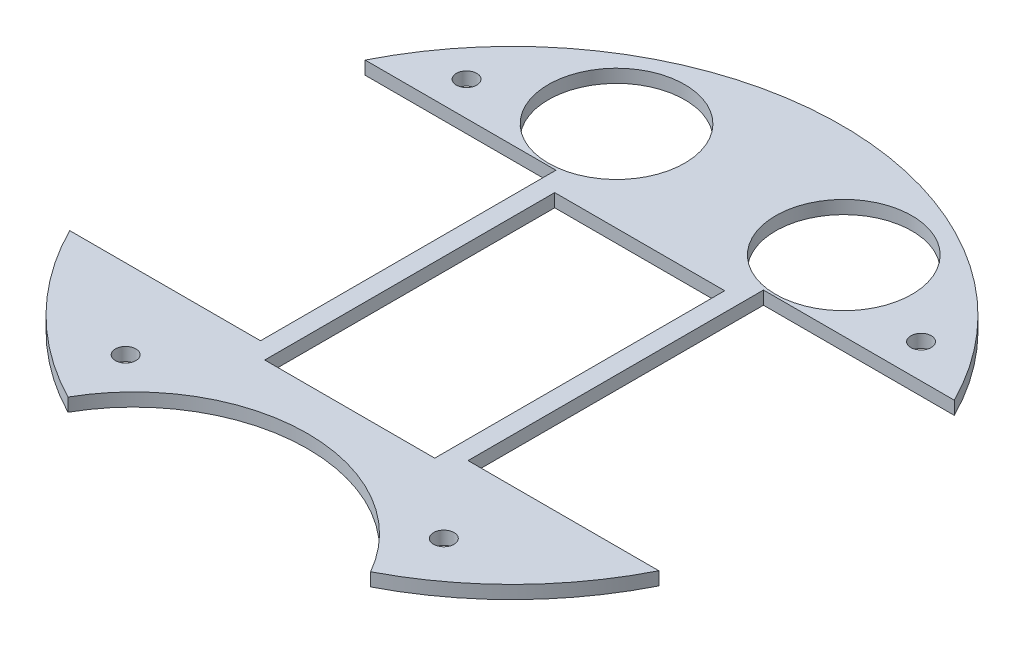
from build123d import *

# Parameters (mm, degrees)
BOSS_EXTRUDE1_DEPTH  = 2.9
SOLENOID_PLACEMENT_W = 37.4
SOLENOID_PLACEMENT_H = 63.8
CUT_EXTRUDE1_DEPTH   = 103.571487266
CUT_EXTRUDE3_DEPTH   = 103.571487266
SKETCH7_R            = 15
CUT_EXTRUDE6_DEPTH   = 98.286484159
SKETCH8_R            = 2.25
CUT_EXTRUDE7_DEPTH   = 98.286484159


with BuildPart() as part:
    # Sketch1 → Boss-Extrude1 (new body)
    with BuildSketch(Plane(origin=(0, 0, 0), x_dir=(1, 0, 0), z_dir=(0, 1, 0))):
        with BuildLine():
            ThreePointArc((33.29110537, -64.404598464), (0, 72.5), (-33.29110537, -64.404598464))
            ThreePointArc((-33.29110537, -64.404598464), (0, -44.989799638), (33.29110537, -64.404598464))
        make_face()
    extrude(amount=BOSS_EXTRUDE1_DEPTH)

    # solenoid placement → Cut-Extrude1 (cut, through all)
    with BuildSketch(Plane(origin=(0, 2.9, 0), x_dir=(1, 0, 0), z_dir=(0, 1, 0))):
        with Locations((0, -3.8)):
            Rectangle(SOLENOID_PLACEMENT_W, SOLENOID_PLACEMENT_H)
    extrude(amount=-CUT_EXTRUDE1_DEPTH, mode=Mode.SUBTRACT)

    # Sketch3 → Cut-Extrude3 (cut, through all)
    with BuildSketch(Plane(origin=(0, 2.9, 0), x_dir=(1, 0, 0), z_dir=(0, 1, 0))):
        with BuildLine():
            Line((-34.63, -32.5), (-22.83, -32.5))
            Line((-22.83, -32.5), (-22.83, 32.5))
            Line((-22.83, 32.5), (-64.807406984, 32.5))
            ThreePointArc((-64.807406984, 32.5), (-72.5, 0), (-64.807406984, -32.5))
            Line((-64.807406984, -32.5), (-34.63, -32.5))
        make_face()
        with BuildLine():
            Line((22.83, -32.5), (22.83, 32.5))
            Line((22.83, 32.5), (64.807406984, 32.5))
            ThreePointArc((64.807406984, 32.5), (72.5, 0), (64.807406984, -32.5))
            Line((64.807406984, -32.5), (34.63, -32.5))
            Line((34.63, -32.5), (22.83, -32.5))
        make_face()
    extrude(amount=-CUT_EXTRUDE3_DEPTH, mode=Mode.SUBTRACT)

    # Sketch7 → Cut-Extrude6 (cut, through all)
    with BuildSketch(Plane(origin=(0, 2.9, 0), x_dir=(1, 0, 0), z_dir=(0, 1, 0))):
        with Locations(Location((25, 48, 0), (0, 0, 270))):
            Circle(SKETCH7_R)
        with Locations(Location((-25, 48, 0), (0, 0, 270))):
            Circle(SKETCH7_R)
    extrude(amount=-CUT_EXTRUDE6_DEPTH, mode=Mode.SUBTRACT)

    # Sketch8 → Cut-Extrude7 (cut, through all)
    with BuildSketch(Plane(origin=(0, 2.9, 0), x_dir=(1, 0, 0), z_dir=(0, 1, 0))):
        with Locations(Location((35, -50, 0), (0, 0, 270))):
            Circle(SKETCH8_R)
        with Locations(Location((-35, -50, 0), (0, 0, 270))):
            Circle(SKETCH8_R)
        with Locations(Location((-50, 40, 0), (0, 0, 270))):
            Circle(SKETCH8_R)
        with Locations(Location((50, 40, 0), (0, 0, 270))):
            Circle(SKETCH8_R)
    extrude(amount=-CUT_EXTRUDE7_DEPTH, mode=Mode.SUBTRACT)


solid = part.part
